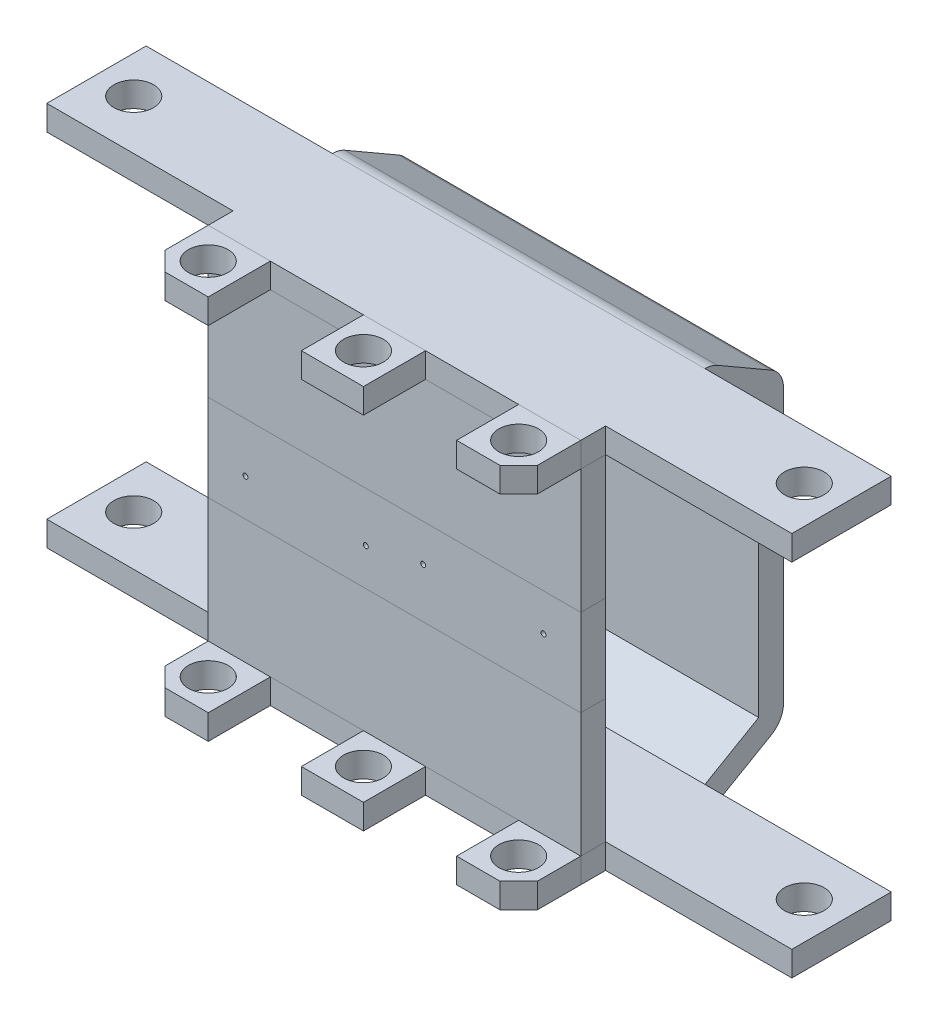
from build123d import *

# Parameters (mm, degrees)
SKETCH1_W              = 300
SKETCH1_H              = 200
BOSS_EXTRUDE1_DEPTH    = 20
SKETCH2_R              = 2
CUT_EXTRUDE1_DEPTH     = 20
SKETCH3_W              = 300
SKETCH3_H              = 130
CUT_EXTRUDE2_DEPTH     = 20
SKETCH4_R              = 2
CUT_EXTRUDE3_DEPTH     = 20
SKETCH5_W              = 300
SKETCH5_H              = 20
BOSS_EXTRUDE2_DEPTH    = 100
SKETCH6_W              = 300
SKETCH6_H              = 20
BOSS_EXTRUDE3_DEPTH    = 100
SKETCH9_W              = 300
SKETCH9_H              = 100
BOSS_EXTRUDE6_DEPTH    = 20
SKETCH10_W             = 300
SKETCH10_H             = 100
BOSS_EXTRUDE7_DEPTH    = 20
SKETCH14_W             = 80
SKETCH14_H             = 20
BOSS_EXTRUDE11_DEPTH   = 150
SKETCH15_W             = 80
SKETCH15_H             = 20
BOSS_EXTRUDE12_DEPTH   = 150
SKETCH16_W             = 80
SKETCH16_H             = 20
BOSS_EXTRUDE13_DEPTH   = 150
SKETCH17_W             = 80
SKETCH17_H             = 20
BOSS_EXTRUDE14_DEPTH   = 150
SKETCH18_R             = 16
CUT_EXTRUDE4_DEPTH     = 20
SKETCH19_R             = 16
CUT_EXTRUDE5_DEPTH     = 20
SKETCH20_R             = 16
CUT_EXTRUDE6_DEPTH     = 20
SKETCH21_R             = 16
CUT_EXTRUDE7_DEPTH     = 20
SKETCH22_W             = 50
SKETCH22_H             = 20
BOSS_EXTRUDE15_DEPTH   = 50
BOSS_EXTRUDE15_2_DEPTH = 50
BOSS_EXTRUDE15_3_DEPTH = 50
SKETCH23_W             = 50
SKETCH23_H             = 20
BOSS_EXTRUDE16_DEPTH   = 50
BOSS_EXTRUDE16_2_DEPTH = 50
BOSS_EXTRUDE16_3_DEPTH = 50
SKETCH24_R             = 16
CUT_EXTRUDE8_DEPTH     = 20
SKETCH25_R             = 16
CUT_EXTRUDE9_DEPTH     = 20
SKETCH26_R             = 16
CUT_EXTRUDE10_DEPTH    = 20
SKETCH27_R             = 16
CUT_EXTRUDE11_DEPTH    = 20
SKETCH28_R             = 16
CUT_EXTRUDE12_DEPTH    = 20
SKETCH29_R             = 16
CUT_EXTRUDE13_DEPTH    = 20
SKETCH30_W             = 300
SKETCH30_H             = 20
REVOLVE1_ANGLE         = 30
SKETCH31_W             = 300
SKETCH31_H             = 20
REVOLVE2_ANGLE         = 30
SKETCH33_W             = 300
SKETCH33_H             = 20
BOSS_EXTRUDE18_DEPTH   = 50
SKETCH34_W             = 300
SKETCH34_H             = 20
BOSS_EXTRUDE19_DEPTH   = 50
SKETCH35_W             = 300
SKETCH35_H             = 20
REVOLVE3_ANGLE         = 60
SKETCH36_W             = 300
SKETCH36_H             = 20
REVOLVE4_ANGLE         = 60
SKETCH37_W             = 300
SKETCH37_H             = 20
BOSS_EXTRUDE20_DEPTH   = 220
SKETCH38_W             = 130
SKETCH38_H             = 30
BOSS_EXTRUDE21_DEPTH   = 1


with BuildPart() as part:
    # Sketch1 → Boss-Extrude1 (new body)
    with BuildSketch(Plane.XY):
        with Locations((-150, 100)):
            Rectangle(SKETCH1_W, SKETCH1_H)
    extrude(amount=BOSS_EXTRUDE1_DEPTH)

    # Sketch2 → Cut-Extrude1 (cut)
    with BuildSketch(Plane.XY.offset(20)):
        with Locations((-270, 160)):
            Circle(SKETCH2_R)
        with Locations((-173.0937277, 160)):
            Circle(SKETCH2_R)
    extrude(amount=-CUT_EXTRUDE1_DEPTH, mode=Mode.SUBTRACT)

    # Sketch3 → Cut-Extrude2 (cut)
    with BuildSketch(Plane(origin=(0, 0, 0), x_dir=(-1, 0, 0), z_dir=(0, 0, -1))):
        with Locations((150, 65)):
            Rectangle(SKETCH3_W, SKETCH3_H)
    extrude(amount=-CUT_EXTRUDE2_DEPTH, mode=Mode.SUBTRACT)

    # Sketch4 → Cut-Extrude3 (cut)
    with BuildSketch(Plane(origin=(0, 0, 0), x_dir=(-1, 0, 0), z_dir=(0, 0, -1))):
        with Locations((30, 170)):
            Circle(SKETCH4_R)
        with Locations((126.9062723, 170)):
            Circle(SKETCH4_R)
    extrude(amount=-CUT_EXTRUDE3_DEPTH, mode=Mode.SUBTRACT)


with BuildPart() as body_2:
    # Sketch5 → Boss-Extrude2 (new body)
    with BuildSketch(Plane(origin=(0, 200, 0), x_dir=(1, 0, 0), z_dir=(0, 1, 0))):
        with Locations((-150, -10)):
            Rectangle(SKETCH5_W, SKETCH5_H)
    extrude(amount=BOSS_EXTRUDE2_DEPTH)


with BuildPart() as body_3:
    # Sketch6 → Boss-Extrude3 (new body)
    with BuildSketch(Plane.XZ.offset(-130)):
        with Locations((-150, 10)):
            Rectangle(SKETCH6_W, SKETCH6_H)
    extrude(amount=BOSS_EXTRUDE3_DEPTH)


with BuildPart() as body_4:
    # Sketch9 → Boss-Extrude6 (new body)
    with BuildSketch(Plane.XZ.offset(-30)):
        with Locations((-150, -30)):
            Rectangle(SKETCH9_W, SKETCH9_H)
    extrude(amount=BOSS_EXTRUDE6_DEPTH)



with BuildPart() as body_5:
    # Sketch10 → Boss-Extrude7 (new body)
    with BuildSketch(Plane(origin=(0, 300, 0), x_dir=(1, 0, 0), z_dir=(0, 1, 0))):
        with Locations((-150, 30)):
            Rectangle(SKETCH10_W, SKETCH10_H)
    extrude(amount=BOSS_EXTRUDE7_DEPTH)



with BuildPart() as body_6:
    # Sketch14 → Boss-Extrude11 (new body)
    with BuildSketch(Plane(origin=(0, 0, 0), x_dir=(0, 0, -1), z_dir=(1, 0, 0))):
        with Locations((40, 310)):
            Rectangle(SKETCH14_W, SKETCH14_H)
    extrude(amount=BOSS_EXTRUDE11_DEPTH)

    # Sketch19 → Cut-Extrude5 (cut)
    with BuildSketch(Plane.XZ.offset(-300)):
        with Locations((120, -40)):
            Circle(SKETCH19_R)
    extrude(amount=-CUT_EXTRUDE5_DEPTH, mode=Mode.SUBTRACT)


with BuildPart() as body_7:
    # Sketch15 → Boss-Extrude12 (new body)
    with BuildSketch(Plane.ZY.offset(300)):
        with Locations((-40, 310)):
            Rectangle(SKETCH15_W, SKETCH15_H)
    extrude(amount=BOSS_EXTRUDE12_DEPTH)

    # Sketch20 → Cut-Extrude6 (cut)
    with BuildSketch(Plane(origin=(0, 320, 0), x_dir=(1, 0, 0), z_dir=(0, 1, 0))):
        with Locations(Location((-420, 40, 0), (0, 0, 180))):
            Circle(SKETCH20_R)
    extrude(amount=-CUT_EXTRUDE6_DEPTH, mode=Mode.SUBTRACT)


with BuildPart() as body_8:
    # Sketch16 → Boss-Extrude13 (new body)
    with BuildSketch(Plane.ZY.offset(300)):
        with Locations((-40, 20)):
            Rectangle(SKETCH16_W, SKETCH16_H)
    extrude(amount=BOSS_EXTRUDE13_DEPTH)

    # Sketch21 → Cut-Extrude7 (cut)
    with BuildSketch(Plane(origin=(0, 30, 0), x_dir=(1, 0, 0), z_dir=(0, 1, 0))):
        with Locations(Location((-420, 40, 0), (0, 0, 180))):
            Circle(SKETCH21_R)
    extrude(amount=-CUT_EXTRUDE7_DEPTH, mode=Mode.SUBTRACT)


with BuildPart() as body_9:
    # Sketch17 → Boss-Extrude14 (new body)
    with BuildSketch(Plane(origin=(0, 0, 0), x_dir=(0, 0, -1), z_dir=(1, 0, 0))):
        with Locations((40, 20)):
            Rectangle(SKETCH17_W, SKETCH17_H)
    extrude(amount=BOSS_EXTRUDE14_DEPTH)

    # Sketch18 → Cut-Extrude4 (cut)
    with BuildSketch(Plane.XZ.offset(-10)):
        with Locations((120, -40)):
            Circle(SKETCH18_R)
    extrude(amount=-CUT_EXTRUDE4_DEPTH, mode=Mode.SUBTRACT)


with BuildPart() as body_10:
    # Sketch22 → Boss-Extrude15 (new body)
    with BuildSketch(Plane.XY.offset(20)):
        with Locations((-275, 310)):
            Rectangle(SKETCH22_W, SKETCH22_H)
    extrude(amount=BOSS_EXTRUDE15_DEPTH)

    # Sketch27 → Cut-Extrude11 (cut)
    with BuildSketch(Plane(origin=(0, 320, 0), x_dir=(1, 0, 0), z_dir=(0, 1, 0))):
        with Locations((-275, -45)):
            Circle(SKETCH27_R)
        Polygon((-300, -55), (-285, -70), (-300, -70), align=None)
    extrude(amount=-CUT_EXTRUDE11_DEPTH, mode=Mode.SUBTRACT)


with BuildPart() as body_11:
    # Sketch22 → Boss-Extrude15 2 (new body)
    with BuildSketch(Plane.XY.offset(20)):
        with Locations((-150, 310)):
            Rectangle(SKETCH22_W, SKETCH22_H)
    extrude(amount=BOSS_EXTRUDE15_2_DEPTH)

    # Sketch28 → Cut-Extrude12 (cut)
    with BuildSketch(Plane(origin=(0, 320, 0), x_dir=(1, 0, 0), z_dir=(0, 1, 0))):
        with Locations(Location((-150, -45, 0), (0, 0, 90))):
            Circle(SKETCH28_R)
    extrude(amount=-CUT_EXTRUDE12_DEPTH, mode=Mode.SUBTRACT)


with BuildPart() as body_12:
    # Sketch22 → Boss-Extrude15 3 (new body)
    with BuildSketch(Plane.XY.offset(20)):
        with Locations((-25, 310)):
            Rectangle(SKETCH22_W, SKETCH22_H)
    extrude(amount=BOSS_EXTRUDE15_3_DEPTH)

    # Sketch29 → Cut-Extrude13 (cut)
    with BuildSketch(Plane(origin=(0, 320, 0), x_dir=(1, 0, 0), z_dir=(0, 1, 0))):
        with Locations((-25, -45)):
            Circle(SKETCH29_R)
        Polygon((0, -55), (-15, -70), (0, -70), align=None)
    extrude(amount=-CUT_EXTRUDE13_DEPTH, mode=Mode.SUBTRACT)


with BuildPart() as body_13:
    # Sketch23 → Boss-Extrude16 (new body)
    with BuildSketch(Plane.XY.offset(20)):
        with Locations((-275, 20)):
            Rectangle(SKETCH23_W, SKETCH23_H)
    extrude(amount=BOSS_EXTRUDE16_DEPTH)

    # Sketch26 → Cut-Extrude10 (cut)
    with BuildSketch(Plane.XZ.offset(-10)):
        with Locations((-275, 45)):
            Circle(SKETCH26_R)
        Polygon((-300, 55), (-285, 70), (-300, 70), align=None)
    extrude(amount=-CUT_EXTRUDE10_DEPTH, mode=Mode.SUBTRACT)


with BuildPart() as body_14:
    # Sketch23 → Boss-Extrude16 2 (new body)
    with BuildSketch(Plane.XY.offset(20)):
        with Locations((-150, 20)):
            Rectangle(SKETCH23_W, SKETCH23_H)
    extrude(amount=BOSS_EXTRUDE16_2_DEPTH)

    # Sketch25 → Cut-Extrude9 (cut)
    with BuildSketch(Plane.XZ.offset(-10)):
        with Locations(Location((-150, 45, 0), (0, 0, 270))):
            Circle(SKETCH25_R)
    extrude(amount=-CUT_EXTRUDE9_DEPTH, mode=Mode.SUBTRACT)


with BuildPart() as body_15:
    # Sketch23 → Boss-Extrude16 3 (new body)
    with BuildSketch(Plane.XY.offset(20)):
        with Locations((-25, 20)):
            Rectangle(SKETCH23_W, SKETCH23_H)
    extrude(amount=BOSS_EXTRUDE16_3_DEPTH)

    # Sketch24 → Cut-Extrude8 (cut)
    with BuildSketch(Plane.XZ.offset(-10)):
        with Locations((-25, 45)):
            Circle(SKETCH24_R)
        Polygon((0, 55), (-15, 70), (0, 70), align=None)
    extrude(amount=-CUT_EXTRUDE8_DEPTH, mode=Mode.SUBTRACT)


with BuildPart() as body_4_1:
    add(body_4.part)

    add(body_8.part)  # Revolve1 merges body 8

    add(body_9.part)  # Revolve1 merges body 9
    # Sketch30 → Revolve1 (revolve)
    with BuildSketch(Plane(origin=(0, 0, -80), x_dir=(-1, 0, 0), z_dir=(0, 0, -1))):
        with Locations((150, 20)):
            Rectangle(SKETCH30_W, SKETCH30_H)
    revolve(axis=Axis((0, 30, -80), (1, 0, 0)), revolution_arc=REVOLVE1_ANGLE)

    # Sketch33 → Boss-Extrude18 (add)
    with BuildSketch(Plane(origin=(0, 42.141016151, -72.990381057), x_dir=(-1, 0, 0), z_dir=(0, 0.500000000000001, -0.8660254037844382))):
        with Locations((150, -24.019237886)):
            Rectangle(SKETCH33_W, SKETCH33_H)
    extrude(amount=BOSS_EXTRUDE18_DEPTH)

    # Sketch35 → Revolve3 (revolve)
    with BuildSketch(Plane(origin=(0, 67.141016151, -116.291651246), x_dir=(-1, 0, 0), z_dir=(0, 0.5000000000000007, -0.8660254037844382))):
        with Locations((150, -24.019237886)):
            Rectangle(SKETCH35_W, SKETCH35_H)
    revolve(axis=Axis((0, 55, -123.301270189), (1, 0, 0)), revolution_arc=REVOLVE3_ANGLE)



with BuildPart() as body_5_1:
    add(body_5.part)

    add(body_6.part)  # Revolve2 merges body 6

    add(body_7.part)  # Revolve2 merges body 7
    # Sketch31 → Revolve2 (revolve)
    with BuildSketch(Plane(origin=(0, 0, -80), x_dir=(-1, 0, 0), z_dir=(0, 0, -1))):
        with Locations((150, 310)):
            Rectangle(SKETCH31_W, SKETCH31_H)
    revolve(axis=Axis((0, 300, -80), (-1, 0, 0)), revolution_arc=REVOLVE2_ANGLE)

    # Sketch34 → Boss-Extrude19 (add)
    with BuildSketch(Plane(origin=(0, 40.358983849, 69.903810568), x_dir=(-1, 0, 0), z_dir=(0, -0.500000000000001, -0.8660254037844382))):
        with Locations((150, 309.807621135)):
            Rectangle(SKETCH34_W, SKETCH34_H)
    extrude(amount=BOSS_EXTRUDE19_DEPTH)

    # Sketch36 → Revolve4 (revolve)
    with BuildSketch(Plane(origin=(0, 15.358983849, 26.602540378), x_dir=(-1, 0, 0), z_dir=(0, -0.5000000000000009, -0.8660254037844383))):
        with Locations((150, 309.807621135)):
            Rectangle(SKETCH36_W, SKETCH36_H)
    revolve(axis=Axis((0, 275, -123.301270189), (-1, 0, 0)), revolution_arc=REVOLVE4_ANGLE)


with BuildPart() as body_4_2:
    add(body_4_1.part)

    add(body_5_1.part)  # Boss-Extrude20 merges body 5
    # Sketch37 → Boss-Extrude20 (add)
    with BuildSketch(Plane(origin=(0, 55, 0), x_dir=(1, 0, 0), z_dir=(0, 1, 0))):
        with Locations((-150, 133.301270189)):
            Rectangle(SKETCH37_W, SKETCH37_H)
    extrude(amount=BOSS_EXTRUDE20_DEPTH)

    # Sketch38 → Boss-Extrude21 (add)
    with BuildSketch(Plane(origin=(0, 0, -143.301270189), x_dir=(-1, 0, 0), z_dir=(0, 0, -1))):
        with Locations((170, 165)):
            Rectangle(SKETCH38_W, SKETCH38_H)
    extrude(amount=BOSS_EXTRUDE21_DEPTH)


solid = Compound([part.part, body_2.part, body_3.part, body_10.part, body_11.part, body_12.part, body_13.part, body_14.part, body_15.part, body_4_2.part])
